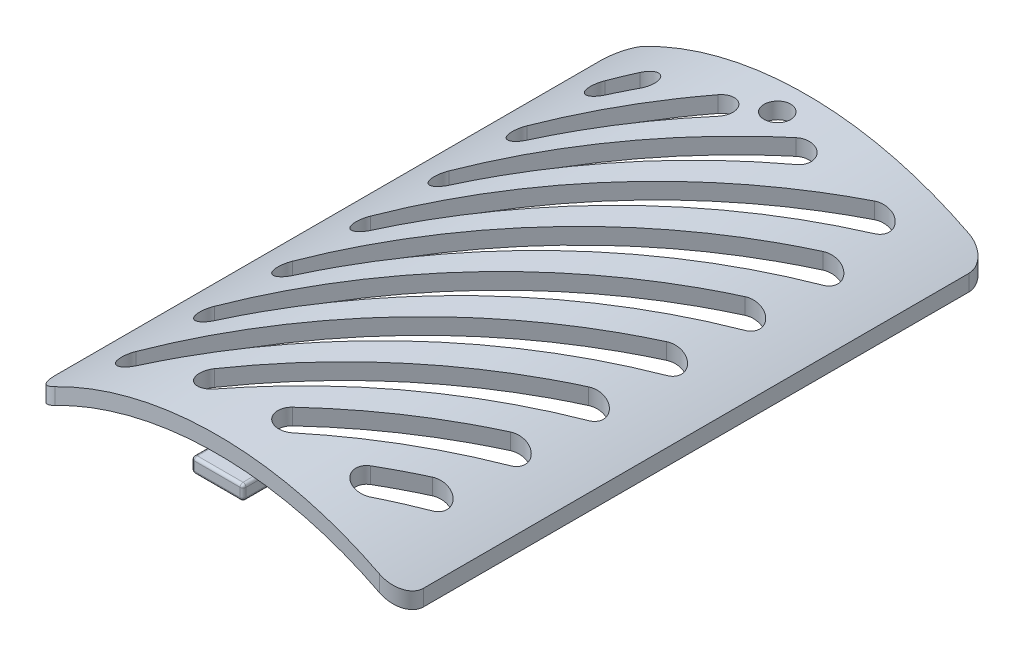
from build123d import *

# Parameters (mm, degrees)
BOSS_EXTRU_1_DEPTH      = 80
BOSS_EXTRU_2_DEPTH      = 3.5
D_GAGEMENT_M31_D        = 3.6
D_GAGEMENT_M31_DEPTH    = 10
D_GAGEMENT_M31_TIP      = 1.081549114
CONG_1_R                = 3
ENL_V_MAT_EXTRU_1_DEPTH = 85.31868134
CONG_2_R                = 0.4


with BuildPart() as part:
    # Esquisse2 → Boss.-Extru.1 (new body)
    with BuildSketch(Plane.XY):
        with BuildLine():
            Line((-25, 0), (-25, 2.2))
            ThreePointArc((-25, 2.2), (0, 9.2), (25, 2.2))
            Line((25, 2.2), (25, 0))
            ThreePointArc((25, 0), (0, 7), (-25, 0))
        make_face()
    extrude(amount=BOSS_EXTRU_1_DEPTH)

    # Esquisse3 → Boss.-Extru.2 (add, symmetric)
    with BuildSketch(Plane(origin=(0, 0, 0), x_dir=(0, 0, -1), z_dir=(1, 0, 0))):
        Polygon((-77.9, 7), (-77.9, 5), (-80, 5), (-80, 3), (-75.9, 3), (-73.9, 5), (-73.9, 7), align=None)
    extrude(amount=BOSS_EXTRU_2_DEPTH, both=True)

    # Dégagement M31
    with Locations(Plane(origin=(0, 9.2, 0), x_dir=(1, 0, 0), z_dir=(0, 1, 0))):
        with Locations((0, -4)):
            Hole(D_GAGEMENT_M31_D / 2, depth=D_GAGEMENT_M31_DEPTH)
            with Locations((0, 0, -(D_GAGEMENT_M31_DEPTH + D_GAGEMENT_M31_TIP / 2))):  # 118° drill point
                Cone(0, D_GAGEMENT_M31_D / 2, D_GAGEMENT_M31_TIP, mode=Mode.SUBTRACT)

    # Congé1
    cong_1_edges = [part.edges().sort_by_distance(p)[0] for p in [
        (-25, 1.1, 80),
        (-25, 1.1, 0),
        (25, 1.1, 0),
        (25, 1.1, 80),
    ]]
    fillet(cong_1_edges, radius=CONG_1_R)

    # Esquisse9 → Enlèv. mat.-Extru.1 (cut, through all)
    with BuildSketch(Plane(origin=(0, 9.2, 0), x_dir=(1, 0, 0), z_dir=(0, 1, 0))):
        with BuildLine():
            Line((-19.414213562, -71.585786438), (16.585786438, -35.585786438))
            ThreePointArc((16.585786438, -35.585786438), (19.414213562, -35.585786438), (19.414213562, -38.414213562))
            Line((19.414213562, -38.414213562), (-16.585786438, -74.414213562))
            ThreePointArc((-16.585786438, -74.414213562), (-19.414213562, -74.414213562), (-19.414213562, -71.585786438))
        make_face()
        with BuildLine():
            Line((-19.414213562, -60.97918472), (16.585786438, -24.97918472))
            ThreePointArc((16.585786438, -24.97918472), (19.414213562, -24.97918472), (19.414213562, -27.807611845))
            Line((19.414213562, -27.807611845), (-16.585786438, -63.807611845))
            ThreePointArc((-16.585786438, -63.807611845), (-19.414213562, -63.807611845), (-19.414213562, -60.97918472))
        make_face()
        with BuildLine():
            Line((-19.414213562, -50.372583002), (16.585786438, -14.372583002))
            ThreePointArc((16.585786438, -14.372583002), (19.414213562, -14.372583002), (19.414213562, -17.201010127))
            Line((19.414213562, -17.201010127), (-16.585786438, -53.201010127))
            ThreePointArc((-16.585786438, -53.201010127), (-19.414213562, -53.201010127), (-19.414213562, -50.372583002))
        make_face()
        with BuildLine():
            Line((-19.414213562, -39.765981284), (14.765981284, -5.585786438))
            ThreePointArc((14.765981284, -5.585786438), (17.594408409, -5.585786438), (17.594408409, -8.414213562))
            Line((17.594408409, -8.414213562), (-16.585786438, -42.594408409))
            ThreePointArc((-16.585786438, -42.594408409), (-19.414213562, -42.594408409), (-19.414213562, -39.765981284))
        make_face()
        with BuildLine():
            Line((-8.807611845, -71.585786438), (16.585786438, -46.192388155))
            ThreePointArc((16.585786438, -46.192388155), (19.414213562, -46.192388155), (19.414213562, -49.02081528))
            Line((19.414213562, -49.02081528), (-5.97918472, -74.414213562))
            ThreePointArc((-5.97918472, -74.414213562), (-8.807611845, -74.414213562), (-8.807611845, -71.585786438))
        make_face()
        with BuildLine():
            Line((1.798989873, -71.585786438), (16.585786438, -56.798989873))
            ThreePointArc((16.585786438, -56.798989873), (19.414213562, -56.798989873), (19.414213562, -59.627416998))
            Line((19.414213562, -59.627416998), (4.627416998, -74.414213562))
            ThreePointArc((4.627416998, -74.414213562), (1.798989873, -74.414213562), (1.798989873, -71.585786438))
        make_face()
        with BuildLine():
            Line((12.405591591, -71.585786438), (16.585786438, -67.405591591))
            ThreePointArc((16.585786438, -67.405591591), (19.414213562, -67.405591591), (19.414213562, -70.234018716))
            Line((19.414213562, -70.234018716), (15.234018716, -74.414213562))
            ThreePointArc((15.234018716, -74.414213562), (12.405591591, -74.414213562), (12.405591591, -71.585786438))
        make_face()
        with BuildLine():
            Line((-19.414213562, -29.159379566), (4.159379566, -5.585786438))
            ThreePointArc((4.159379566, -5.585786438), (6.987806691, -5.585786438), (6.987806691, -8.414213562))
            Line((6.987806691, -8.414213562), (-16.585786438, -31.987806691))
            ThreePointArc((-16.585786438, -31.987806691), (-19.414213562, -31.987806691), (-19.414213562, -29.159379566))
        make_face()
        with BuildLine():
            Line((-19.414213562, -18.552777849), (-6.447222151, -5.585786438))
            ThreePointArc((-6.447222151, -5.585786438), (-3.618795027, -5.585786438), (-3.618795027, -8.414213562))
            Line((-3.618795027, -8.414213562), (-16.585786438, -21.381204973))
            ThreePointArc((-16.585786438, -21.381204973), (-19.414213562, -21.381204973), (-19.414213562, -18.552777849))
        make_face()
        with BuildLine():
            Line((-19.414213562, -7.946176131), (-17.053823869, -5.585786438))
            ThreePointArc((-17.053823869, -5.585786438), (-14.225396744, -5.585786438), (-14.225396744, -8.414213562))
            Line((-14.225396744, -8.414213562), (-16.585786438, -10.774603256))
            ThreePointArc((-16.585786438, -10.774603256), (-19.414213562, -10.774603256), (-19.414213562, -7.946176131))
        make_face()
    extrude(amount=-ENL_V_MAT_EXTRU_1_DEPTH, mode=Mode.SUBTRACT)

    # Congé2
    cong_2_edges = [part.edges().sort_by_distance(p)[0] for p in [
        (3.5, 5, 78.95),
        (3.5, 4, 80),
        (3.5, 3, 77.95),
        (-3.5, 5, 78.95),
        (-3.5, 4, 80),
        (0, 5, 80),
        (-3.5, 3, 77.95),
        (0, 3, 80),
    ]]
    fillet(cong_2_edges, radius=CONG_2_R)


solid = part.part
